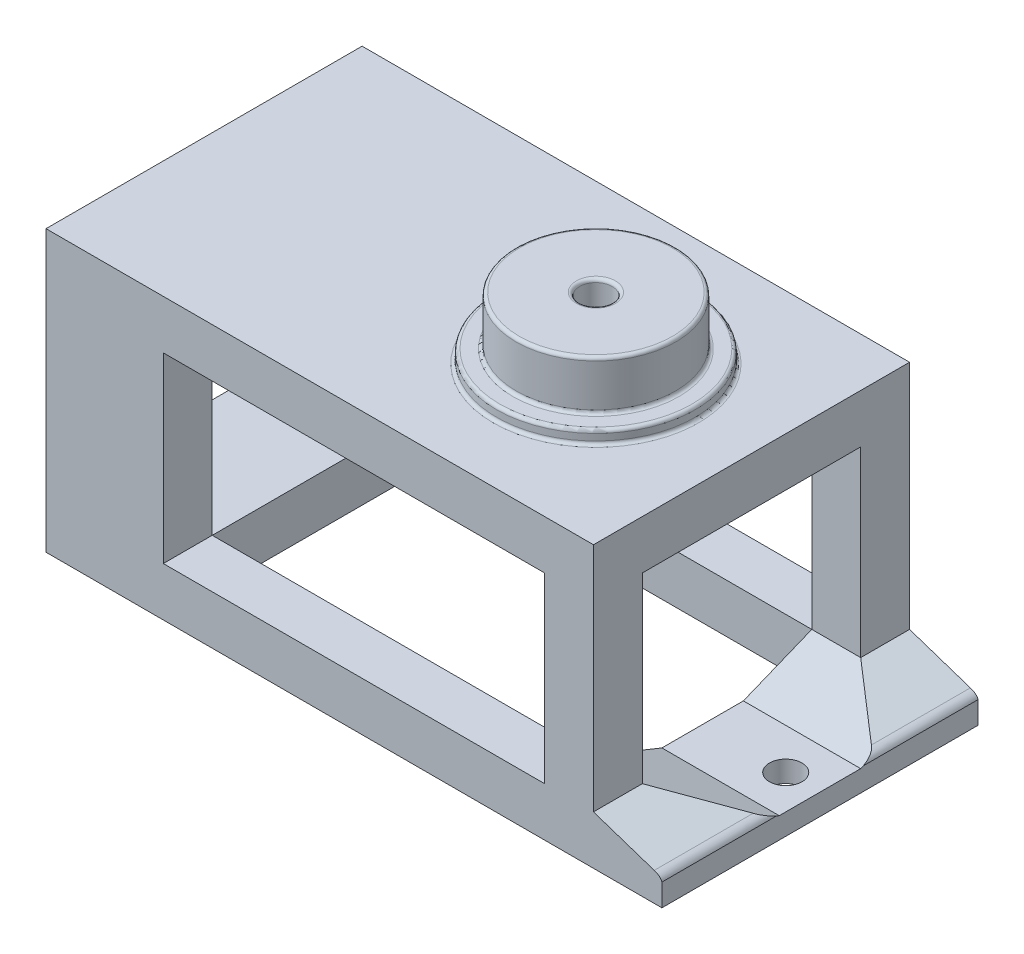
from build123d import *

# Parameters (mm, degrees)
SKETCH_1_W          = 29.4
SKETCH_1_H          = 19.4
SKETCH_1_W_2        = 23.4
SKETCH_1_H_2        = 13.4
EXTRUDE_1_DEPTH     = 16.4
SKETCH_2_W          = 29.4
SKETCH_2_H          = 19.4
EXTRUDE_2_DEPTH     = 0.8
SKETCH_3_R          = 6.1
EXTRUDE_3_DEPTH     = 0.8
SKETCH_5_R          = 4.9
SKETCH_5_R_2        = 1
EXTRUDE_4_DEPTH     = 3
FILLET_1_R          = 0.2
SKETCH_7_W          = 13.4
SKETCH_7_H          = 5.6
CUT_EXTRUDE_2_DEPTH = 30
SKETCH_8_W          = 23.4
SKETCH_8_H          = 5.6
CUT_EXTRUDE_3_DEPTH = 30
SKETCH_9_W          = 19.4
SKETCH_9_H          = 3
EXTRUDE_5_DEPTH     = 4.2
CUT_EXTRUDE_4_DEPTH = 20.2
CUT_EXTRUDE_5_DEPTH = 5.1
SKETCH_12_R         = 1
CUT_EXTRUDE_6_DEPTH = 2.2
EXTRUDE_6_DEPTH     = 4.2


with BuildPart() as part:
    # 草图1 → 凸台-拉伸1 (new body)
    with BuildSketch(Plane(origin=(0, 0, 0), x_dir=(1, 0, 0), z_dir=(0, 1, 0))):
        Rectangle(SKETCH_1_W, SKETCH_1_H)
        Rectangle(SKETCH_1_W_2, SKETCH_1_H_2, mode=Mode.SUBTRACT)
    extrude(amount=EXTRUDE_1_DEPTH)

    # 草图2 → 凸台-拉伸2 (add)
    with BuildSketch(Plane(origin=(0, 16.4, 0), x_dir=(1, 0, 0), z_dir=(0, 1, 0))):
        Rectangle(SKETCH_2_W, SKETCH_2_H)
    extrude(amount=EXTRUDE_2_DEPTH)

    # 草图3 → 凸台-拉伸3 (add)
    with BuildSketch(Plane(origin=(0, 17.2, 0), x_dir=(1, 0, 0), z_dir=(0, 1, 0))):
        with Locations(Location((5.15, 0, 0), (0, 0, 270))):
            Circle(SKETCH_3_R)
    extrude(amount=EXTRUDE_3_DEPTH)

    # 草图5 → 凸台-拉伸4 (add)
    with BuildSketch(Plane(origin=(0, 18, 0), x_dir=(1, 0, 0), z_dir=(0, 1, 0))):
        with Locations(Location((5.15, 0, 0), (0, 0, 270))):
            Circle(SKETCH_5_R)
        with Locations(Location((5.15, 0, 0), (0, 0, 270))):
            Circle(SKETCH_5_R_2, mode=Mode.SUBTRACT)
    extrude(amount=EXTRUDE_4_DEPTH)

    # 圆角1
    fillet_1_edges = [part.edges().sort_by_distance(p)[0] for p in [
        (5.15, 17.2, -6.1),
        (5.15, 18, -6.1),
        (5.15, 18, -1),
        (5.15, 21, -4.9),
        (5.15, 18, -4.9),
        (5.15, 21, -1),
    ]]
    fillet(fillet_1_edges, radius=FILLET_1_R)

    # 草图7 → 切除-拉伸2 (cut)
    with BuildSketch(Plane.ZY.offset(14.7)):
        with Locations((0, 11.4)):
            Rectangle(SKETCH_7_W, SKETCH_7_H)
        with Locations((0, 5.8)):
            Rectangle(SKETCH_7_W, SKETCH_7_H)
    extrude(amount=-CUT_EXTRUDE_2_DEPTH, mode=Mode.SUBTRACT)

    # 草图8 → 切除-拉伸3 (cut)
    with BuildSketch(Plane(origin=(0, 0, -9.7), x_dir=(-1, 0, 0), z_dir=(0, 0, -1))):
        with Locations((0, 11.4)):
            Rectangle(SKETCH_8_W, SKETCH_8_H)
        with Locations((0, 5.8)):
            Rectangle(SKETCH_8_W, SKETCH_8_H)
    extrude(amount=-CUT_EXTRUDE_3_DEPTH, mode=Mode.SUBTRACT)

    # 草图9 → 凸台-拉伸5 (add)
    with BuildSketch(Plane(origin=(14.7, 0, 0), x_dir=(0, 0, -1), z_dir=(1, 0, 0))):
        with Locations((0, 1.5)):
            Rectangle(SKETCH_9_W, SKETCH_9_H)
    extrude_5 = extrude(amount=EXTRUDE_5_DEPTH)

    # 草图10 → 切除-拉伸4 (cut)
    with BuildSketch(Plane.XY.offset(9.7)):
        with BuildLine():
            add(Edge.make_bspline(
                [(18.486644801, 1.737785066), (18.825886074, 1.616028978), (18.9, 1.36920832)],
                knots=[0.049557912, 0.049557912, 0.049557912, 0.659174515, 0.659174515, 0.659174515], degree=2))
            Line((18.9, 1.36920832), (18.9, 1.6))
            Line((18.9, 1.6), (18.9, 3))
            Line((18.9, 3), (14.7, 3))
            Line((14.7, 3), (18.429736397, 1.756754534))
            add(Edge.make_bspline(
                [(18.429736397, 1.756754534), (18.459066665, 1.747683054), (18.486644801, 1.737785066)],
                knots=[0, 0, 0, 0.049557912, 0.049557912, 0.049557912], degree=2))
        make_face()
    extrude(amount=-CUT_EXTRUDE_4_DEPTH, mode=Mode.SUBTRACT)

    # 草图11 → 切除-拉伸5 (cut, symmetric)
    with BuildSketch(Plane(origin=(14.7, 0, 0), x_dir=(0, 0, -1), z_dir=(1, 0, 0))):
        Polygon((2.5, 1.3), (6.7, 3), (-6.7, 3), (-2.5, 1.3), align=None)
    extrude(amount=CUT_EXTRUDE_5_DEPTH, both=True, mode=Mode.SUBTRACT)

    # 草图12 → 切除-拉伸6 (cut)
    with BuildSketch(Plane(origin=(0, 1.3, 0), x_dir=(1, 0, 0), z_dir=(0, 1, 0))):
        with Locations(Location((16.8, 0, 0), (0, 0, 270))):
            Circle(SKETCH_12_R)
    cut_extrude_6 = extrude(amount=-CUT_EXTRUDE_6_DEPTH, mode=Mode.SUBTRACT)

    # 镜向1: 凸台-拉伸5, 切除-拉伸6 across plane
    add(extrude_5.mirror(Plane(origin=(0, 0, 0), x_dir=(0, 0, 1), z_dir=(1, 0, 0))))
    add(cut_extrude_6.mirror(Plane(origin=(0, 0, 0), x_dir=(0, 0, 1), z_dir=(1, 0, 0))), mode=Mode.SUBTRACT)

    # 草图13 → 凸台-拉伸6 (add)
    with BuildSketch(Plane.ZY.offset(14.7)):
        Polygon((-6.7, 3), (-9.7, 3), (-9.7, 17.2), (9.7, 17.2), (9.7, 3), (6.7, 3), (6.7, 14.2), (-6.7, 14.2), align=None)
    extrude(amount=EXTRUDE_6_DEPTH)


solid = part.part
